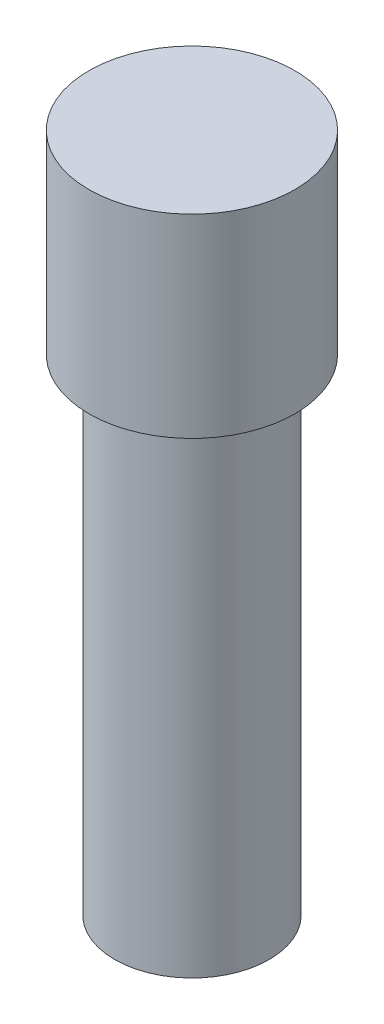
from build123d import *

# Parameters (mm, degrees)
CROQUIS2_R              = 4.775
SALIENTE_EXTRUIR1_DEPTH = 30
CROQUIS3_R              = 6.365
SALIENTE_EXTRUIR2_DEPTH = 12


with BuildPart() as part:
    # Croquis2 → Saliente-Extruir1 (new body)
    with BuildSketch(Plane(origin=(0, 0, 0), x_dir=(1, 0, 0), z_dir=(0, 1, 0))):
        with Locations(Location((0, 0, 0), (0, 0, 270))):
            Circle(CROQUIS2_R)
    extrude(amount=SALIENTE_EXTRUIR1_DEPTH)

    # Croquis3 → Saliente-Extruir2 (add)
    with BuildSketch(Plane(origin=(0, 30, 0), x_dir=(1, 0, 0), z_dir=(0, 1, 0))):
        with Locations(Location((0, 0, 0), (0, 0, 270))):
            Circle(CROQUIS3_R)
    extrude(amount=SALIENTE_EXTRUIR2_DEPTH)


solid = part.part
